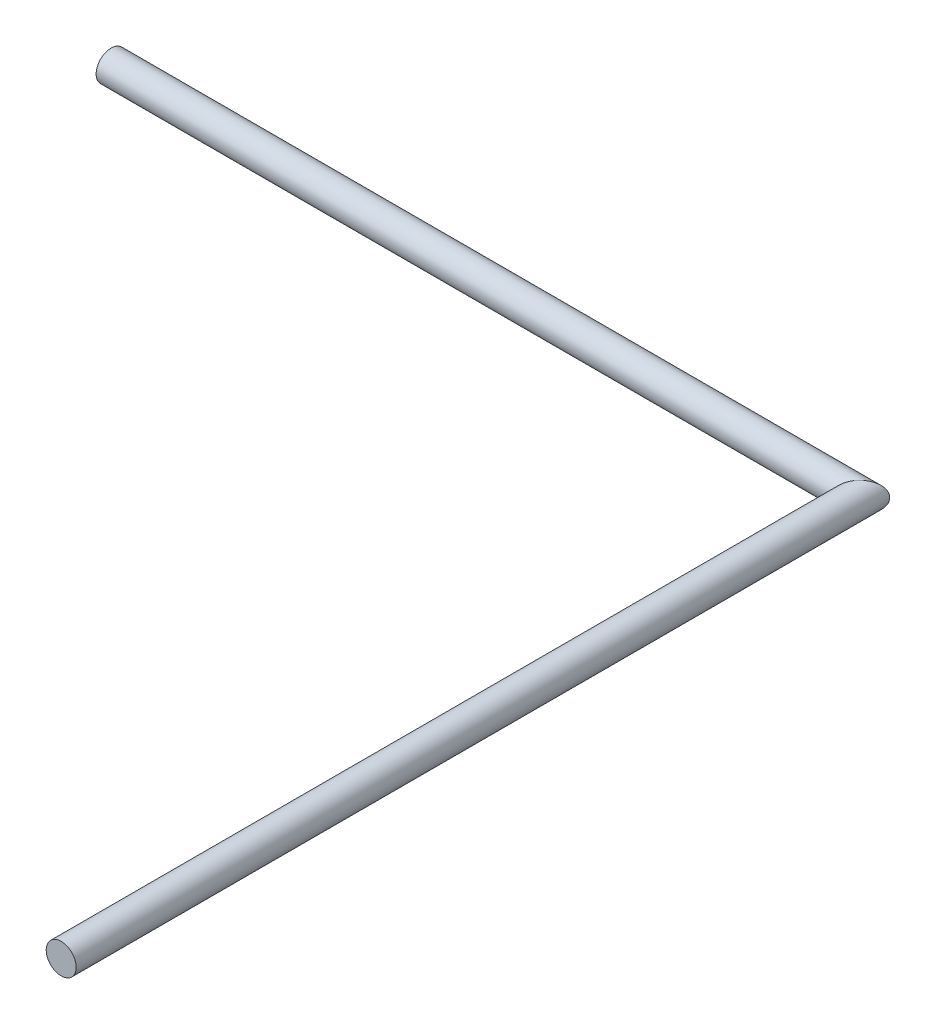
from build123d import *

# Parameters (mm, degrees)
SKETCH2_R = 3


with BuildPart() as part:
    # Sweep1: sweep along a path in Sketch1
    with BuildLine(Plane(origin=(0, 0, 0), x_dir=(1, 0, 0), z_dir=(0, 1, 0))) as sweep1_path:
        Line((0, 0), (150, 0))
        Line((150, 0), (150, -160))
    # Sketch2 → Sweep1 (sweep)
    with BuildSketch(Plane(origin=(0, 0, 0), x_dir=(0, 0, -1), z_dir=(1, 0, 0))):
        Circle(SKETCH2_R)
    sweep(path=sweep1_path.line, transition=Transition.RIGHT)


solid = part.part
